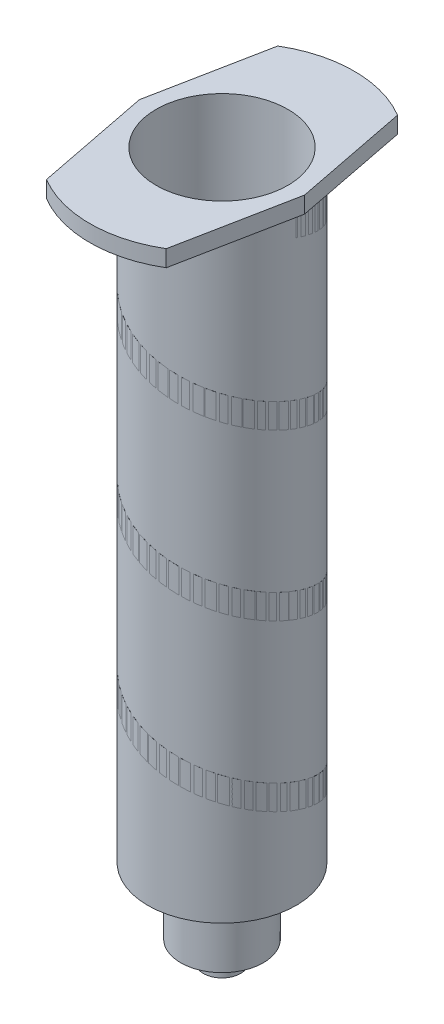
from build123d import *

# Parameters (mm, degrees)
SKETCH2_R           = 8.98
SKETCH2_R_2         = 7.98
BOSS_EXTRUDE1_DEPTH = 73
BOSS_EXTRUDE2_DEPTH = 2
SKETCH6_R           = 5
SKETCH6_R_2         = 2.25
BOSS_EXTRUDE3_DEPTH = 0.5
BOSS_EXTRUDE4_START = 7
SKETCH7_R           = 5
SKETCH7_R_2         = 4
BOSS_EXTRUDE4_DEPTH = 7
SKETCH8_R           = 2.25
SKETCH8_R_2         = 1.25
BOSS_EXTRUDE5_DEPTH = 9.5
SKETCH9_R           = 7.98
CUT_EXTRUDE2_DEPTH  = 9.5
SWEEP1_PITCH        = 20
SWEEP1_HEIGHT       = 70
SWEEP1_RADIUS       = 8.98
SWEEP1_START_ANGLE  = 90
SKETCH10_W          = 0.125
SKETCH10_H          = 3


with BuildPart() as part:
    # Sketch2 → Boss-Extrude1 (new body)
    with BuildSketch(Plane(origin=(0, 0, 0), x_dir=(1, 0, 0), z_dir=(0, 1, 0))):
        Circle(SKETCH2_R)
        Circle(SKETCH2_R_2, mode=Mode.SUBTRACT)
    extrude(amount=BOSS_EXTRUDE1_DEPTH)

    # Sketch3 → Boss-Extrude2 (add)
    with BuildSketch(Plane(origin=(0, 73, 0), x_dir=(1, 0, 0), z_dir=(0, 1, 0))):
        with BuildLine():
            Line((-7.25, 14), (-10, 0))
            Line((-10, 0), (-7.25, -14))
            ThreePointArc((-7.25, -14), (0, -16), (7.25, -14))
            Line((7.25, -14), (10, 0))
            Line((10, 0), (7.25, 14))
            ThreePointArc((7.25, 14), (0, 16), (-7.25, 14))
        make_face()
    extrude(amount=BOSS_EXTRUDE2_DEPTH)

    # Sketch4 → Revolve1 (revolve)
    with BuildSketch(Plane(origin=(0, 0, 0), x_dir=(0, 0, -1), z_dir=(1, 0, 0))):
        Polygon((8.98, 0), (5, 0), (5, -1), align=None)
    revolve(axis=Axis((0, 0, 0), (0, -1, 0)))

    # Sketch9 → Cut-Extrude2 (cut)
    with BuildSketch(Plane.XZ.offset(-73)):
        Circle(SKETCH9_R)
    extrude(amount=-CUT_EXTRUDE2_DEPTH, mode=Mode.SUBTRACT)


with BuildPart() as body_2:
    # Sketch6 → Boss-Extrude3 (new body)
    with BuildSketch(Plane(origin=(0, -1, 0), x_dir=(-1, 0, 0), z_dir=(0, -1, 0))):
        Circle(SKETCH6_R)
        Circle(SKETCH6_R_2, mode=Mode.SUBTRACT)
    extrude(amount=BOSS_EXTRUDE3_DEPTH)

    # Sketch7 → Boss-Extrude4 (add)
    with BuildSketch(Plane(origin=(0, -1, 0), x_dir=(-1, 0, 0), z_dir=(0, -1, 0)).offset(BOSS_EXTRUDE4_START)):
        Circle(SKETCH7_R)
        Circle(SKETCH7_R_2, mode=Mode.SUBTRACT)
    extrude(amount=-BOSS_EXTRUDE4_DEPTH)

    # Sketch8 → Boss-Extrude5 (add)
    with BuildSketch(Plane(origin=(0, -1, 0), x_dir=(-1, 0, 0), z_dir=(0, -1, 0))):
        Circle(SKETCH8_R)
        Circle(SKETCH8_R_2, mode=Mode.SUBTRACT)
    extrude(amount=BOSS_EXTRUDE5_DEPTH)


with BuildPart() as body_3:
    # Sweep1: sweep along a helix
    with BuildLine() as sweep1_path:
        add(Helix(SWEEP1_PITCH, SWEEP1_HEIGHT, SWEEP1_RADIUS, center=(0, 71.5, 0), direction=(0, -1, 0), lefthand=True, mode=Mode.PRIVATE).rotate(Axis((0, 71.5, 0), (0, -1, 0)), SWEEP1_START_ANGLE))
    # Sketch10 → Sweep1 (sweep)
    with BuildSketch(Plane.XY):
        with Locations((-8.9175, 1.5)):
            Rectangle(SKETCH10_W, SKETCH10_H)
    sweep(path=sweep1_path.line, is_frenet=True)


solid = Compound([part.part, body_2.part, body_3.part])
